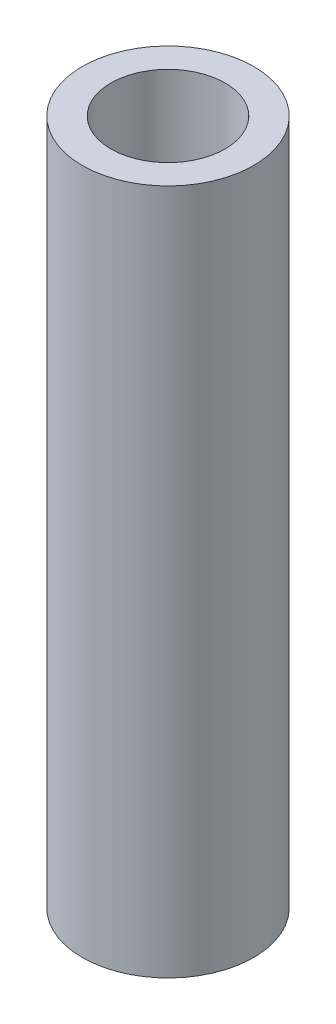
from build123d import *

# Parameters (mm, degrees)
SKETCH2_R           = 5.715
SKETCH2_R_2         = 3.81
BOSS_EXTRUDE1_DEPTH = 45.72


with BuildPart() as part:
    # Sketch2 → Boss-Extrude1 (new body)
    with BuildSketch(Plane(origin=(0, 0, 0), x_dir=(1, 0, 0), z_dir=(0, 1, 0))):
        with Locations(Location((0, 0, 0), (0, 0, 270))):
            Circle(SKETCH2_R)
        with Locations(Location((0, 0, 0), (0, 0, 270))):
            Circle(SKETCH2_R_2, mode=Mode.SUBTRACT)
    extrude(amount=BOSS_EXTRUDE1_DEPTH)


solid = part.part
